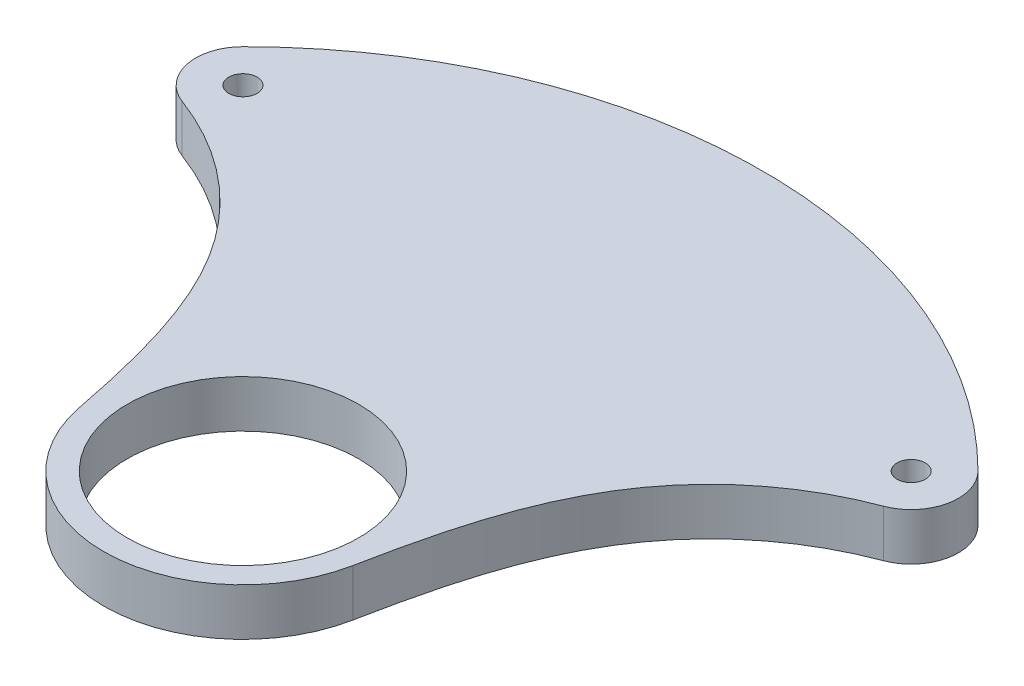
from build123d import *

# Parameters (mm, degrees)
SKETCH2_R           = 12.25
BOSS_EXTRUDE1_DEPTH = 5
CUT_EXTRUDE1_REACH  = 70.4
SKETCH3_R           = 1.5


with BuildPart() as part:
    # Sketch2 → Boss-Extrude1 (new body)
    # profile 1 of 6: a face of its own
    with BuildSketch(Plane(origin=(0, 0, 0), x_dir=(1, 0, 0), z_dir=(0, 1, 0))):
        with BuildLine():
            ThreePointArc((-37.10126952, 30.670072063), (-34.291787618, 30.469762498), (-31.819805153, 31.819805153))
            Line((-31.819805153, 31.819805153), (-38.890872965, 38.890872965))
            ThreePointArc((-38.890872965, 38.890872965), (-40.24091562, 34.291787618), (-37.10126952, 30.670072063))
        make_face()
    # profile 2 of 6: a face of its own
    with BuildSketch(Plane(origin=(0, 0, 0), x_dir=(1, 0, 0), z_dir=(0, 1, 0))):
        with BuildLine():
            Line((-38.890872965, 38.890872965), (-31.819805153, 31.819805153))
            ThreePointArc((-31.819805153, 31.819805153), (0, 45), (31.819805153, 31.819805153))
            ThreePointArc((31.819805153, 31.819805153), (34.291787618, 30.469762498), (37.10126952, 30.670072063))
            ThreePointArc((37.10126952, 30.670072063), (40.24091562, 34.291787618), (38.890872965, 38.890872965))
            ThreePointArc((38.890872965, 38.890872965), (0, 55), (-38.890872965, 38.890872965))
        make_face()
    # profile 3 of 6: a face of its own
    with BuildSketch(Plane(origin=(0, 0, 0), x_dir=(1, 0, 0), z_dir=(0, 1, 0))):
        with BuildLine():
            ThreePointArc((31.819805153, 31.819805153), (0, 45), (-31.819805153, 31.819805153))
            ThreePointArc((-31.819805153, 31.819805153), (-32.980620877, 30.615006885), (-34.095849533, 29.367891389))
            add(Edge.make_bspline(
                [(-34.095849533, 29.367891389), (-29.412092921, 27.041011889), (-19.283887533, 18.248514738), (-16.048568895, 5.169213632), (-14.472968185, -2.845292938)],
                knots=[0.074524007, 0.074524007, 0.074524007, 0.074524007, 0.434164212, 1, 1, 1, 1], degree=3))
            ThreePointArc((-14.472968185, -2.845292938), (-1.42937386, 14.68057868), (14.75, 0))
            ThreePointArc((14.75, 0), (14.68057868, -1.42937386), (14.472968185, -2.845292938))
            add(Edge.make_bspline(
                [(34.095849533, 29.367891389), (29.412092921, 27.041011889), (19.283887533, 18.248514738), (16.048568895, 5.169213632), (14.472968185, -2.845292938)],
                knots=[0.074524007, 0.074524007, 0.074524007, 0.074524007, 0.434164212, 1, 1, 1, 1], degree=3))
            ThreePointArc((34.095849533, 29.367891389), (32.980620877, 30.615006885), (31.819805153, 31.819805153))
        make_face()
    # profile 4 of 6: a face of its own
    with BuildSketch(Plane(origin=(0, 0, 0), x_dir=(1, 0, 0), z_dir=(0, 1, 0))):
        with BuildLine():
            ThreePointArc((-34.095849533, 29.367891389), (-32.980620877, 30.615006885), (-31.819805153, 31.819805153))
            ThreePointArc((-31.819805153, 31.819805153), (-34.291787618, 30.469762498), (-37.10126952, 30.670072063))
            add(Edge.make_bspline(
                [(-37.10126952, 30.670072063), (-36.069084867, 30.285436005), (-35.066409295, 29.850063244), (-34.095849533, 29.367891389)],
                knots=[0, 0, 0, 0, 0.074524007, 0.074524007, 0.074524007, 0.074524007], degree=3))
        make_face()
    # profile 5 of 6: a face of its own
    with BuildSketch(Plane(origin=(0, 0, 0), x_dir=(1, 0, 0), z_dir=(0, 1, 0))):
        with BuildLine():
            ThreePointArc((37.10126952, 30.670072063), (34.291787618, 30.469762498), (31.819805153, 31.819805153))
            ThreePointArc((31.819805153, 31.819805153), (32.980620877, 30.615006885), (34.095849533, 29.367891389))
            add(Edge.make_bspline(
                [(37.10126952, 30.670072063), (36.069084867, 30.285436005), (35.066409295, 29.850063244), (34.095849533, 29.367891389)],
                knots=[0, 0, 0, 0, 0.074524007, 0.074524007, 0.074524007, 0.074524007], degree=3))
        make_face()
    # profile 6 of 6: a face of its own
    with BuildSketch(Plane(origin=(0, 0, 0), x_dir=(1, 0, 0), z_dir=(0, 1, 0))):
        with BuildLine():
            ThreePointArc((14.75, 0), (-1.42937386, 14.68057868), (-14.472968185, -2.845292938))
            ThreePointArc((-14.472968185, -2.845292938), (0, -14.75), (14.472968185, -2.845292938))
            ThreePointArc((14.472968185, -2.845292938), (14.68057868, -1.42937386), (14.75, 0))
        make_face()
        with Locations(Location((0, 0, 0), (0, 0, 270))):
            Circle(SKETCH2_R, mode=Mode.SUBTRACT)
    extrude(amount=BOSS_EXTRUDE1_DEPTH)

    # Sketch3 → Cut-Extrude1 (cut, up to next)
    with BuildSketch(Plane(origin=(0, 5, 0), x_dir=(1, 0, 0), z_dir=(0, 1, 0)), mode=Mode.PRIVATE) as cut_extrude1_sk1:
        with Locations(Location((-35.355339059, 35.355339059, 0), (0, 0, 270))):
            Circle(SKETCH3_R)
    cut_extrude1_tool1 = extrude(cut_extrude1_sk1.sketch, amount=-CUT_EXTRUDE1_REACH, mode=Mode.PRIVATE) & part.part
    # Sketch3 → Cut-Extrude1 (cut, up to next)
    with BuildSketch(Plane(origin=(0, 5, 0), x_dir=(1, 0, 0), z_dir=(0, 1, 0)), mode=Mode.PRIVATE) as cut_extrude1_sk2:
        with Locations(Location((35.355339059, 35.355339059, 0), (0, 0, 270))):
            Circle(SKETCH3_R)
    cut_extrude1_tool2 = extrude(cut_extrude1_sk2.sketch, amount=-CUT_EXTRUDE1_REACH, mode=Mode.PRIVATE) & part.part
    add(cut_extrude1_tool1.solids().sort_by_distance((-35.355339, 5, -35.355339))[0], mode=Mode.SUBTRACT)
    add(cut_extrude1_tool2.solids().sort_by_distance((35.355339, 5, -35.355339))[0], mode=Mode.SUBTRACT)


solid = part.part
